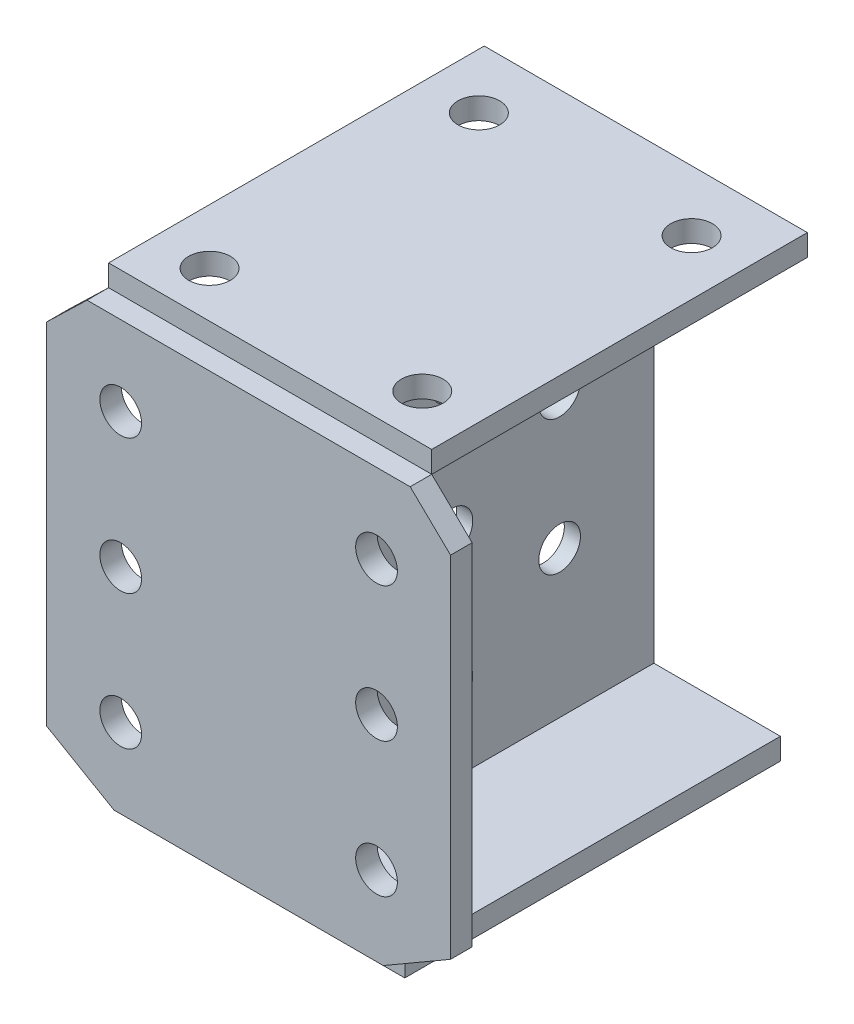
from build123d import *

# Parameters (mm, degrees)
EXTRUDE_1_DEPTH     = 139.5
EXTRUDE_2_DEPTH     = 16
SKETCH_3_R          = 15.5
CUT_EXTRUDE_3_DEPTH = 375.366130947
SKETCH_4_R          = 15.5
CUT_EXTRUDE_4_DEPTH = 16
SKETCH_5_R          = 15.5
CUT_EXTRUDE_5_DEPTH = 16


with BuildPart() as part:
    # 草图1 → 拉伸1 (new, symmetric)
    with BuildSketch(Plane.XY):
        Polygon((-120, 175), (120, 175), (120, 159), (6, 159), (6, -159), (100, -159), (100, -175), (-100, -175), (-100, -159), (-6, -159), (-6, 159), (-120, 159), align=None)
    extrude(amount=EXTRUDE_1_DEPTH, both=True)

    # 草图4 → 拉伸4 (cut)
    with BuildSketch(Plane.ZY.offset(6)):
        with Locations((10.5, 100)):
            Circle(SKETCH_4_R)
        with Locations((10.5, 0)):
            Circle(SKETCH_4_R)
        with Locations((10.5, -100)):
            Circle(SKETCH_4_R)
        with Locations((-69.5, 50)):
            Circle(SKETCH_4_R)
        with Locations((-69.5, -50)):
            Circle(SKETCH_4_R)
    extrude(amount=-CUT_EXTRUDE_4_DEPTH, mode=Mode.SUBTRACT)

    # 草图5 → 拉伸5 (cut)
    with BuildSketch(Plane(origin=(0, 175, 0), x_dir=(1, 0, 0), z_dir=(0, 1, 0))):
        with Locations(Location((79, -105.5, 0), (0, 0, 270))):
            Circle(SKETCH_5_R)
        with Locations(Location((79, 94.5, 0), (0, 0, 270))):
            Circle(SKETCH_5_R)
        with Locations(Location((-79, 94.5, 0), (0, 0, 90))):
            Circle(SKETCH_5_R)
        with Locations(Location((-79, -105.5, 0), (0, 0, 90))):
            Circle(SKETCH_5_R)
    extrude(amount=-CUT_EXTRUDE_5_DEPTH, mode=Mode.SUBTRACT)


with BuildPart() as body_2:
    # 草图2 → 拉伸2 (new body)
    with BuildSketch(Plane.XY.offset(139.5)):
        Polygon((-150, 130), (-150, -130), (-100, -159), (100, -159), (150, -130), (150, 130), (120, 159), (-120, 159), align=None)
    extrude(amount=EXTRUDE_2_DEPTH)

    # 草图3 → 拉伸3 (cut, through all)
    with BuildSketch(Plane.XY.offset(155.5)):
        with Locations((-95, 100)):
            Circle(SKETCH_3_R)
        with Locations((-95, 0)):
            Circle(SKETCH_3_R)
        with Locations((-95, -100)):
            Circle(SKETCH_3_R)
        with Locations(Location((95, -100, 0), (0, 0, 180))):
            Circle(SKETCH_3_R)
        with Locations(Location((95, 0, 0), (0, 0, 180))):
            Circle(SKETCH_3_R)
        with Locations(Location((95, 100, 0), (0, 0, 180))):
            Circle(SKETCH_3_R)
    extrude(amount=-CUT_EXTRUDE_3_DEPTH, mode=Mode.SUBTRACT)


solid = Compound([part.part, body_2.part])
